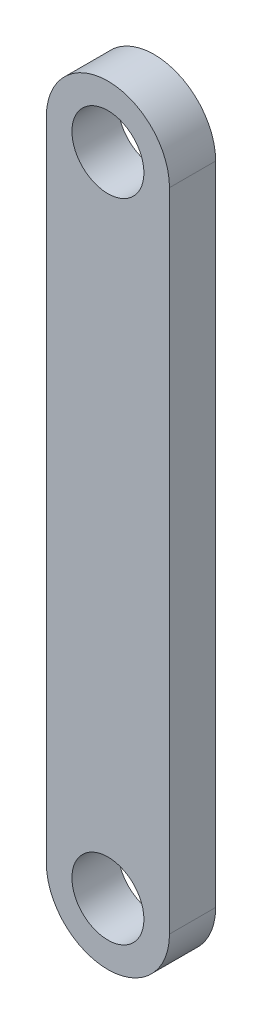
from build123d import *

# Parameters (mm, degrees)
SKETCH1_R           = 2.34
BOSS_EXTRUDE1_DEPTH = 3


with BuildPart() as part:
    # Sketch1 → Boss-Extrude1 (new body)
    with BuildSketch(Plane.XY):
        with BuildLine():
            Line((-4, 42), (-4, 0))
            ThreePointArc((-4, 0), (0, -4), (4, 0))
            Line((4, 0), (4, 42))
            ThreePointArc((4, 42), (0, 46), (-4, 42))
        make_face()
        Circle(SKETCH1_R, mode=Mode.SUBTRACT)
        with Locations((0, 42)):
            Circle(SKETCH1_R, mode=Mode.SUBTRACT)
    extrude(amount=BOSS_EXTRUDE1_DEPTH)


solid = part.part
